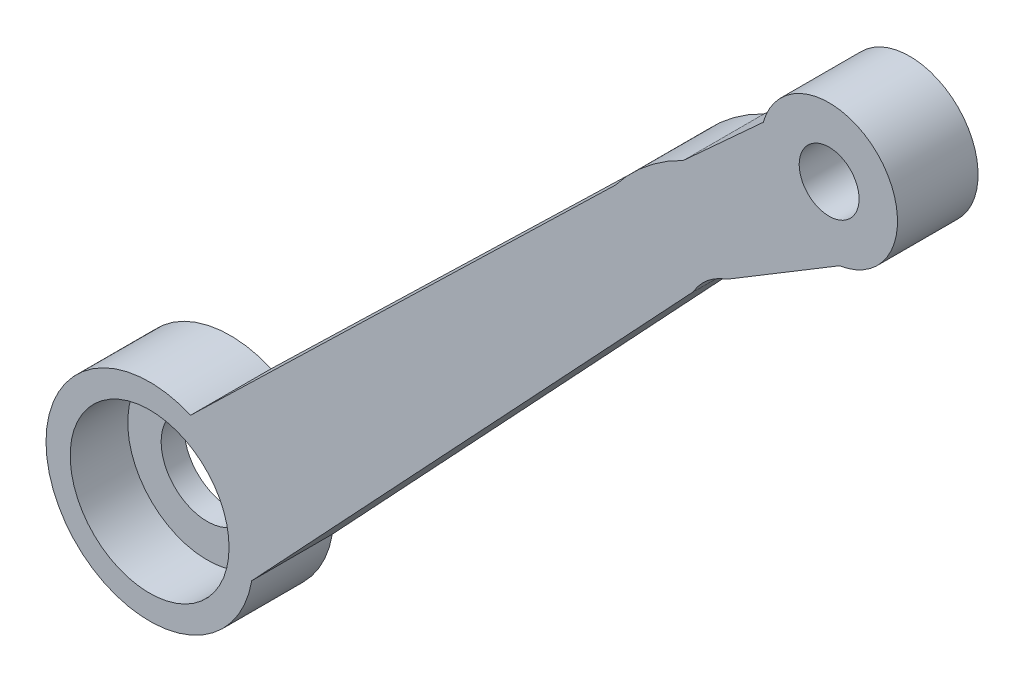
from build123d import *

# Parameters (mm, degrees)
SKETCH1_R           = 2.6
SKETCH1_R_2         = 6.9
BOSS_EXTRUDE1_DEPTH = 5
BOSS_EXTRUDE2_START = 2
SKETCH2_R           = 4
SKETCH2_R_2         = 2.6
BOSS_EXTRUDE2_DEPTH = 2


with BuildPart() as part:
    # Sketch1 → Boss-Extrude1 (new body)
    with BuildSketch(Plane.XY):
        with BuildLine():
            Line((-116.116459466, -73.116163472), (-77.780395614, -32.221656848))
            ThreePointArc((-77.780395614, -32.221656848), (-76.528201342, -30.740668075), (-74.833515464, -29.797610273))
            Line((-74.833515464, -29.797610273), (-65.058269204, -23.896184603))
            ThreePointArc((-65.058269204, -23.896184603), (-61.52405595, -14.086356432), (-71.687164611, -16.417582375))
            Line((-71.687164611, -16.417582375), (-78.635941465, -22.763122171))
            ThreePointArc((-78.635941465, -22.763122171), (-81.861894444, -24.820779517), (-84.529701766, -27.563684997))
            Line((-84.529701766, -27.563684997), (-121.430579381, -63.327828505))
            ThreePointArc((-121.430579381, -63.327828505), (-132.896560675, -75.889442497), (-116.116459466, -73.116163472))
        make_face()
        with Locations((-65.969197132, -18.026447785)):
            Circle(SKETCH1_R, mode=Mode.SUBTRACT)
        with Locations((-124.987033061, -71.595333402)):
            Circle(SKETCH1_R_2, mode=Mode.SUBTRACT)
    extrude(amount=BOSS_EXTRUDE1_DEPTH)

    # Sketch2 → Boss-Extrude2 (add)
    with BuildSketch(Plane(origin=(0, 0, 0), x_dir=(-1, 0, 0), z_dir=(0, 0, -1)).offset(BOSS_EXTRUDE2_START)):
        with BuildLine():
            Line((121.430579381, -63.327828505), (84.529701766, -27.563684997))
            ThreePointArc((84.529701766, -27.563684997), (81.861894444, -24.820779517), (78.635941465, -22.763122171))
            Line((78.635941465, -22.763122171), (71.687164611, -16.417582375))
            ThreePointArc((71.687164611, -16.417582375), (61.52405595, -14.086356432), (65.058269204, -23.896184603))
            Line((65.058269204, -23.896184603), (74.833515464, -29.797610273))
            ThreePointArc((74.833515464, -29.797610273), (76.528201342, -30.740668075), (77.780395614, -32.221656848))
            Line((77.780395614, -32.221656848), (116.116459466, -73.116163472))
            ThreePointArc((116.116459466, -73.116163472), (132.896560675, -75.889442497), (121.430579381, -63.327828505))
        make_face()
        with Locations((124.987033061, -71.595333402)):
            Circle(SKETCH2_R, mode=Mode.SUBTRACT)
        with Locations((65.969197132, -18.026447785)):
            Circle(SKETCH2_R_2, mode=Mode.SUBTRACT)
    extrude(amount=-BOSS_EXTRUDE2_DEPTH)


solid = part.part
